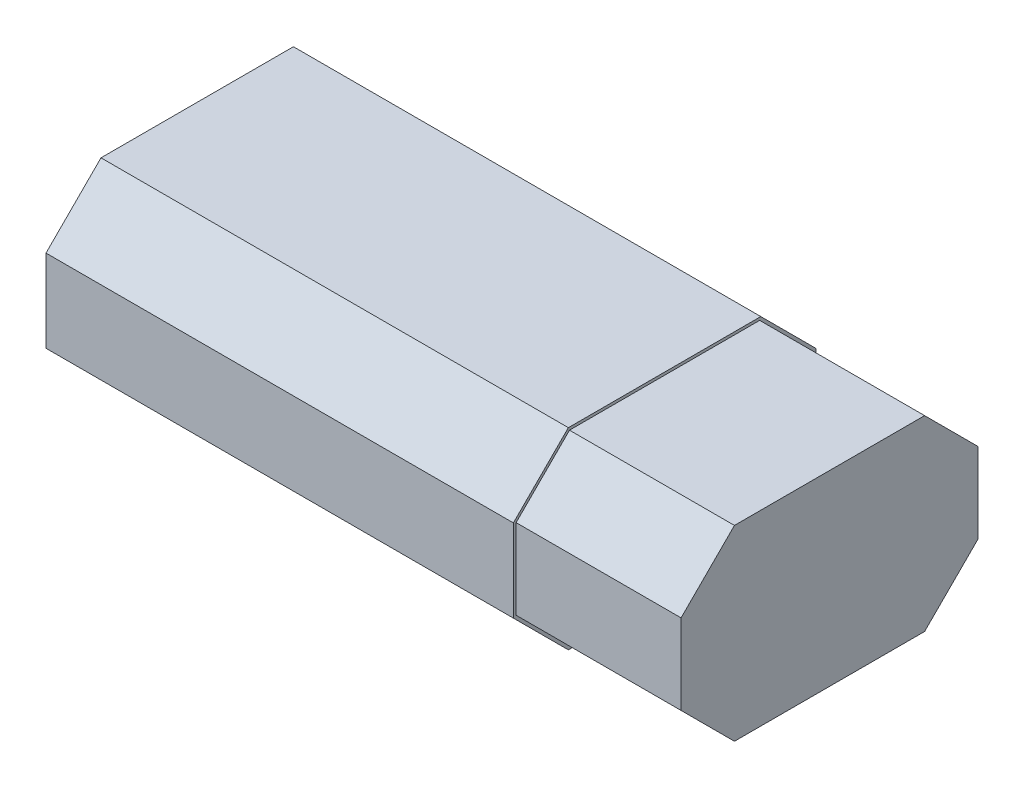
from build123d import *

# Parameters (mm, degrees)
BOSS_EXTRUDE1_DEPTH = 115
CUT_EXTRUDE1_DEPTH  = 30


with BuildPart() as part:
    # Sketch1 → Boss-Extrude1 (new body)
    with BuildSketch(Plane(origin=(0, 0, 0), x_dir=(0, 0, -1), z_dir=(1, 0, 0))):
        Polygon((-17.5, 17.5), (-27.5, 7.5), (-27.5, -7.5), (-17.5, -17.5), (17.5, -17.5), (27.5, -7.5), (27.5, 7.5), (17.5, 17.5), align=None)
    extrude(amount=BOSS_EXTRUDE1_DEPTH)

    # Sketch2 → Cut-Extrude1 (cut)
    with BuildSketch(Plane(origin=(115, 0, 0), x_dir=(0, 0, -1), z_dir=(1, 0, 0))):
        Polygon((27.5, 7.5), (17.5, 17.5), (-17.5, 17.5), (-27.5, 7.5), (-27.5, -7.5), (-17.5, -17.5), (17.5, -17.5), (27.5, -7.5), align=None)
        Polygon((27, 7.292893219), (17.292893219, 17), (-17.292893219, 17), (-27, 7.292893219), (-27, -7.292893219), (-17.292893219, -17), (17.292893219, -17), (27, -7.292893219), align=None, mode=Mode.SUBTRACT)
    extrude(amount=-CUT_EXTRUDE1_DEPTH, mode=Mode.SUBTRACT)


solid = part.part
